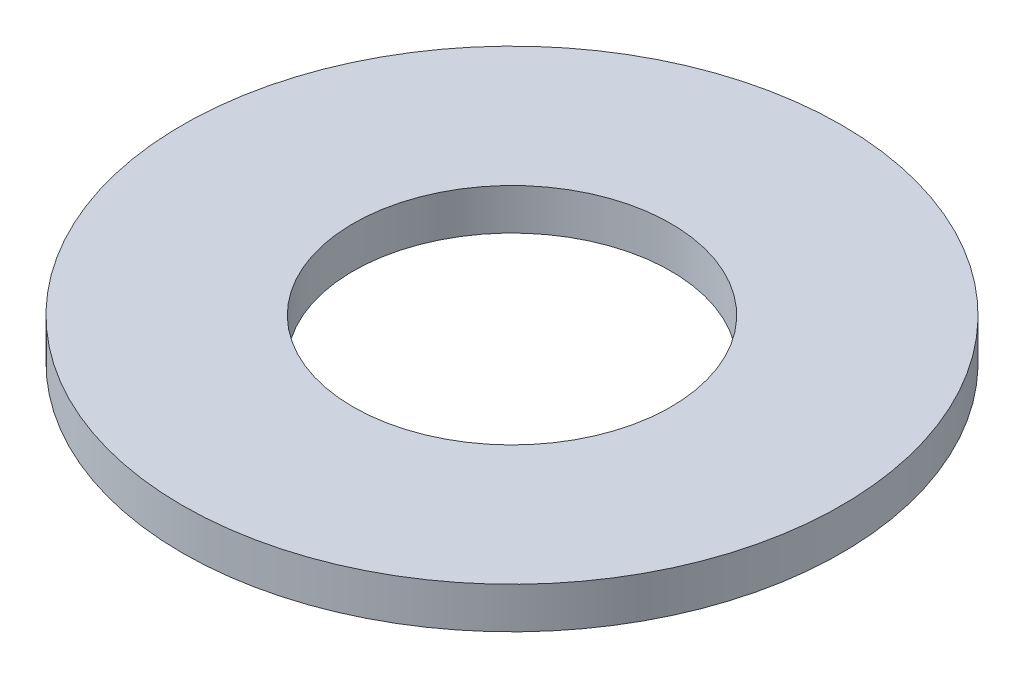
from build123d import *

# Parameters (mm, degrees)
SKETCH1_R           = 5.6
SKETCH1_R_2         = 2.7
BOSS_EXTRUDE1_DEPTH = 0.7


with BuildPart() as part:
    # Sketch1 → Boss-Extrude1 (new body)
    with BuildSketch(Plane(origin=(0, 0, 0), x_dir=(1, 0, 0), z_dir=(0, 1, 0))):
        with Locations(Location((0, 0, 0), (0, 0, 270))):
            Circle(SKETCH1_R)
        with Locations(Location((0, 0, 0), (0, 0, 270))):
            Circle(SKETCH1_R_2, mode=Mode.SUBTRACT)
    extrude(amount=BOSS_EXTRUDE1_DEPTH)


solid = part.part
